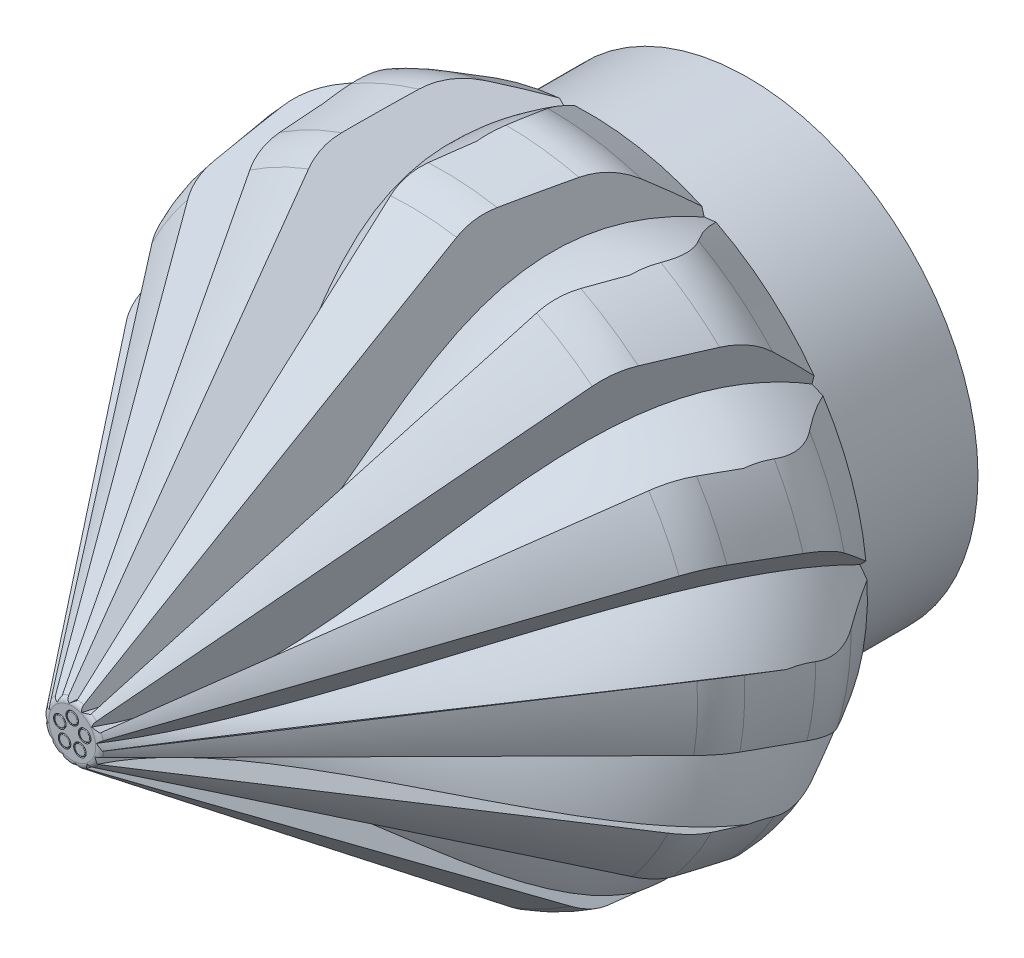
from build123d import *

# Parameters (mm, degrees)
CHAMFER_1_SIZE           = 10
CHAMFER_1_SIZE2          = 8.18798532
CUT_EXTRUDE_1_DEPTH      = 119.461382479
CUT_EXTRUDE_1_DEPTH_BACK = 119.461382479
FILLET_2_R               = 10
FILLET_3_R               = 1
CUT_REVOLVE_2_ANGLE      = 15
PATTERN_CIRCULAR_1_COUNT = 12
SKETCH_7_R               = 1.5
CUT_EXTRUDE_2_DEPTH      = 2
SKETCH_7_2_R             = 1.5
CUT_EXTRUDE_3_DEPTH      = 10
SKETCH_9_R               = 0.9
SKETCH_9_R_2             = 0.8
CUT_EXTRUDE_1_2_DEPTH    = 10
FILLET_4_R               = 0.1


with BuildPart() as part:
    # 草图1 → 旋转2 (revolve)
    with BuildSketch(Plane(origin=(0, 0, 0), x_dir=(0, 0, -1), z_dir=(1, 0, 0))):
        Polygon((0, 34), (-10.475397355, 34), (-36.456159469, 49), (-100, 0), (2, 0), (2, 34), align=None)
    revolve(axis=Axis((0, 0, -2), (0, 0, 1)))

    # 倒角1
    chamfer_1_edges = [part.edges().sort_by_distance(p)[0] for p in [
        (0, -49, 36.456159469),
    ]]
    chamfer_1_side = [part.faces().sort_by_distance(p)[0] for p in [
        (0, -24.5, 68.228079734),
    ]]
    chamfer(chamfer_1_edges, length=CHAMFER_1_SIZE, length2=CHAMFER_1_SIZE2, reference=chamfer_1_side[0])

    # 草图2 → Cut-Extrude 1 (cut, two sides: drawn at the far end of the back side and taken through both)
    with BuildSketch(Plane(origin=(0, 0, 0), x_dir=(1, 0, 0), z_dir=(0, 1, 0)).offset(-CUT_EXTRUDE_1_DEPTH_BACK)):
        Polygon((0, -332.895039106), (0, -100), (0, -95), (6.48406536, -95), (5.558422057, -105.466086699), (-10.51986155, -103.136989541), (-9.341138766, -95), (0, -95), (232.895039106, -95), (-99.947498005, 230.846961702), (-332.842537111, -7.048077404), align=None)
    extrude(amount=CUT_EXTRUDE_1_DEPTH + CUT_EXTRUDE_1_DEPTH_BACK, mode=Mode.SUBTRACT)


with BuildPart() as cut_extrude_1_kept_piece:
    # of the separate pieces the step leaves, the one the design keeps (cut_extrude_1_pieces_kept)
    add(part.part.solids().sort_by_distance((0, 44.90600734, 29.365156176))[0])

    # 圆角2
    fillet_2_edges = [cut_extrude_1_kept_piece.edges().sort_by_distance(p)[0] for p in [
        (0, -44.90600734, 29.365156176),
        (0, -42.893491739, 44.375159207),
    ]]
    fillet(fillet_2_edges, radius=FILLET_2_R)

    # 圆角3
    fillet_3_edges = [cut_extrude_1_kept_piece.edges().sort_by_distance(p)[0] for p in [
        (0, -3.855605798, 95),
    ]]
    fillet(fillet_3_edges, radius=FILLET_3_R)

    # 草图6 → 切除-旋转2 (revolve, cut)
    with BuildSketch(Plane(origin=(30.148005926, 0, 9.882517878), x_dir=(0.31149163589549245, 0, -0.9502488941151944), z_dir=(0.9502488941151945, 0, 0.3114916358954925))):
        with BuildLine():
            Line((-11.677629298, 58.613549392), (-13.726408981, 36.291889861))
            add(Edge.make_bspline(
                [(-90.273644941, 3.363941211), (-58.050736819, 1.985569976), (-48.087303566, 49.153107516), (-13.726408981, 36.291889861)],
                knots=[0, 0, 0, 0, 1, 1, 1, 1], degree=3))
            Line((-90.273644941, 3.363941211), (-97.185388146, 3.363941211))
            Line((-97.185388146, 3.363941211), (-97.185388146, 58.613549392))
            Line((-97.185388146, 58.613549392), (-11.677629298, 58.613549392))
        make_face()
    cut_revolve_2 = revolve(axis=Axis((30.148005926, 0, 9.882517878), (-0.31149163589549245, 0, 0.9502488941151944)), revolution_arc=CUT_REVOLVE_2_ANGLE, mode=Mode.SUBTRACT)

    # 阵列(圆周)1: 切除-旋转2 ×12 about axis
    pattern_circular_1_axis = Axis((0, 0, 0), (0, 0, 1))
    for i in range(1, PATTERN_CIRCULAR_1_COUNT):
        add(cut_revolve_2.rotate(pattern_circular_1_axis, i * 360 / PATTERN_CIRCULAR_1_COUNT), mode=Mode.SUBTRACT)

    # 草图7 → 切除-拉伸2 (cut)
    with BuildSketch(Plane(origin=(0, 0, -2), x_dir=(-1, 0, 0), z_dir=(0, 0, -1))):
        with Locations(Location((0, 0, 0), (0, 0, 90))):
            Circle(SKETCH_7_R)
    extrude(amount=-CUT_EXTRUDE_2_DEPTH, mode=Mode.SUBTRACT)

    # 草图8 → 切除-旋转3 (revolve, cut)
    with BuildSketch(Plane(origin=(0, 0, 0), x_dir=(0, 0, -1), z_dir=(1, 0, 0)), mode=Mode.PRIVATE) as cut_revolve_3_sk:
        Polygon((-20.867702201, 33), (2, 33), (2, 40), (-20.867702201, 40), (-20.867702201, 34), align=None)
    revolve(cut_revolve_3_sk.sketch.rotate(Axis((0, 0, 0), (0, 0, -1)), 90), axis=Axis((0, 0, 0), (0, 0, -1)), mode=Mode.SUBTRACT)

    # 草图7<2> → 切除-拉伸3 (cut)
    with BuildSketch(Plane(origin=(0, 0, -2), x_dir=(-1, 0, 0), z_dir=(0, 0, -1))):
        with Locations(Location((0, 0, 0), (0, 0, 90))):
            Circle(SKETCH_7_2_R)
    extrude(amount=-CUT_EXTRUDE_3_DEPTH, mode=Mode.SUBTRACT)

    # 草图9 → Cut-Extrude 1 2 (cut)
    # profile 1 of 5: a face of its own
    with BuildSketch(Plane.XY.offset(95)):
        with Locations((0, 1.873730931)):
            Circle(SKETCH_9_R)
        with Locations((0, 1.873730931)):
            Circle(SKETCH_9_R_2, mode=Mode.SUBTRACT)
    # profile 2 of 5: a face of its own
    with BuildSketch(Plane.XY.offset(95)):
        with Locations((1.782024012, 0.579014701)):
            Circle(SKETCH_9_R)
        with Locations((1.782024012, 0.579014701)):
            Circle(SKETCH_9_R_2, mode=Mode.SUBTRACT)
    # profile 3 of 5: a face of its own
    with BuildSketch(Plane.XY.offset(95)):
        with Locations((1.101351408, -1.515880166)):
            Circle(SKETCH_9_R)
        with Locations((1.101351408, -1.515880166)):
            Circle(SKETCH_9_R_2, mode=Mode.SUBTRACT)
    # profile 4 of 5: a face of its own
    with BuildSketch(Plane.XY.offset(95)):
        with Locations((-1.101351408, -1.515880166)):
            Circle(SKETCH_9_R)
        with Locations((-1.101351408, -1.515880166)):
            Circle(SKETCH_9_R_2, mode=Mode.SUBTRACT)
    # profile 5 of 5: a face of its own
    with BuildSketch(Plane.XY.offset(95)):
        with Locations((-1.782024012, 0.579014701)):
            Circle(SKETCH_9_R)
        with Locations((-1.782024012, 0.579014701)):
            Circle(SKETCH_9_R_2, mode=Mode.SUBTRACT)
    extrude(amount=-CUT_EXTRUDE_1_2_DEPTH, mode=Mode.SUBTRACT)

    # 圆角4
    fillet_4_edges = [cut_extrude_1_kept_piece.edges().sort_by_distance(p)[0] for p in [
        (-2.582024012, 0.579014701, 95),
        (-1.901351408, -1.515880166, 95),
        (0.301351408, -1.515880166, 95),
        (0.982024012, 0.579014701, 95),
        (-0.8, 1.873730931, 95),
    ]]
    fillet(fillet_4_edges, radius=FILLET_4_R)


solid = cut_extrude_1_kept_piece.part
